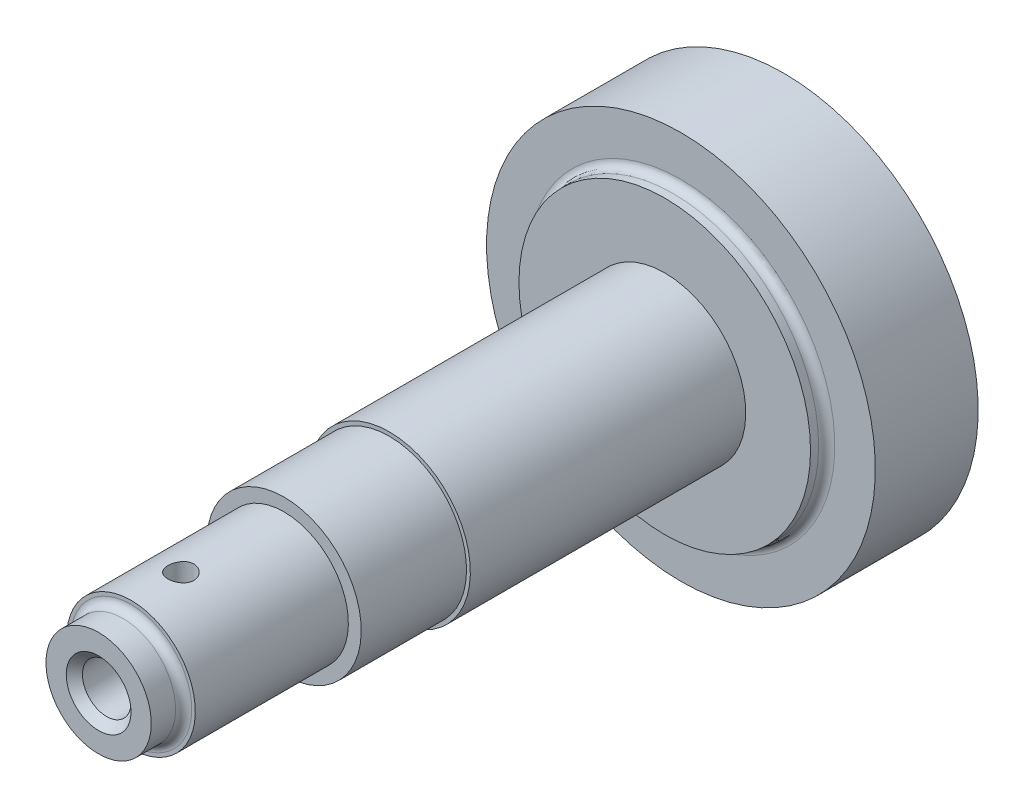
from build123d import *

# Parameters (mm, degrees)
SKETCH4_W               = 0.8
SKETCH4_H               = 12
M2_5_TAPPED_HOLE1_D     = 2.05
M2_5_TAPPED_HOLE1_DEPTH = 5.35
M2_5_TAPPED_HOLE1_TIP   = 0.615882135
FILLET1_R               = 0.5
CHAMFER1_SIZE           = 0.5


with BuildPart() as part:
    # Sketch1 → Revolve1 (revolve)
    with BuildSketch(Plane(origin=(0, 0, 0), x_dir=(0, 0, -1), z_dir=(1, 0, 0))):
        with BuildLine():
            Line((0, 0), (-23.949, 0))
            Line((-23.949, 0), (-23.949, 1.5))
            Line((-23.949, 1.5), (-34.949, 1.5))
            Line((-34.949, 1.5), (-34.949, 3.25))
            Line((-34.949, 3.25), (-33.449, 3.25))
            ThreePointArc((-33.449, 3.25), (-33.095446609, 3.396446609), (-32.949, 3.75))
            Line((-32.949, 3.75), (-32.949, 3.96875))
            Line((-32.949, 3.96875), (-23.5, 3.96875))
            Line((-23.5, 3.96875), (-23.5, 4.7625))
            Line((-23.5, 4.7625), (-17, 4.7625))
            Line((-17, 4.7625), (-17, 5))
            Line((-17, 5), (0, 5))
            Line((0, 5), (0, 9))
            Line((0, 9), (1, 9))
            Line((1, 9), (1, 12))
            Line((1, 12), (7.35, 12))
            Line((7.35, 12), (7.35, 0))
            Line((7.35, 0), (0, 0))
        make_face()
    revolve(axis=Axis((0, 0, -7.35), (0, 0, 1)))

    # Sketch4 → M2 Tapped Hole1 (revolve, cut)
    with BuildSketch(Plane(origin=(0, 0, 29.869), x_dir=(0, 0, -1), z_dir=(1, 0, 0))):
        with Locations((0.4, 6)):
            Rectangle(SKETCH4_W, SKETCH4_H)
    revolve(axis=Axis((0, -6.35, 29.869), (0, 1, 0)), mode=Mode.SUBTRACT)

    # M2.5 Tapped Hole1
    with Locations(Plane(origin=(0, 0, -7.35), x_dir=(1, 0, 0), z_dir=(0, 0, -1))):
        with Locations((0, -8), (6.92820323, -4), (6.92820323, 4), (0, 8), (-6.92820323, 4), (-6.92820323, -4)):
            Hole(M2_5_TAPPED_HOLE1_D / 2, depth=M2_5_TAPPED_HOLE1_DEPTH)
            with Locations((0, 0, -(M2_5_TAPPED_HOLE1_DEPTH + M2_5_TAPPED_HOLE1_TIP / 2))):  # 118° drill point
                Cone(0, M2_5_TAPPED_HOLE1_D / 2, M2_5_TAPPED_HOLE1_TIP, mode=Mode.SUBTRACT)

    # Fillet1
    fillet1_edges = [part.edges().sort_by_distance(p)[0] for p in [
        (0, -9, -1),
    ]]
    fillet(fillet1_edges, radius=FILLET1_R)

    # Chamfer1
    chamfer1_edges = [part.edges().sort_by_distance(p)[0] for p in [
        (0, -1.5, 34.949),
    ]]
    chamfer(chamfer1_edges, length=CHAMFER1_SIZE)


solid = part.part
